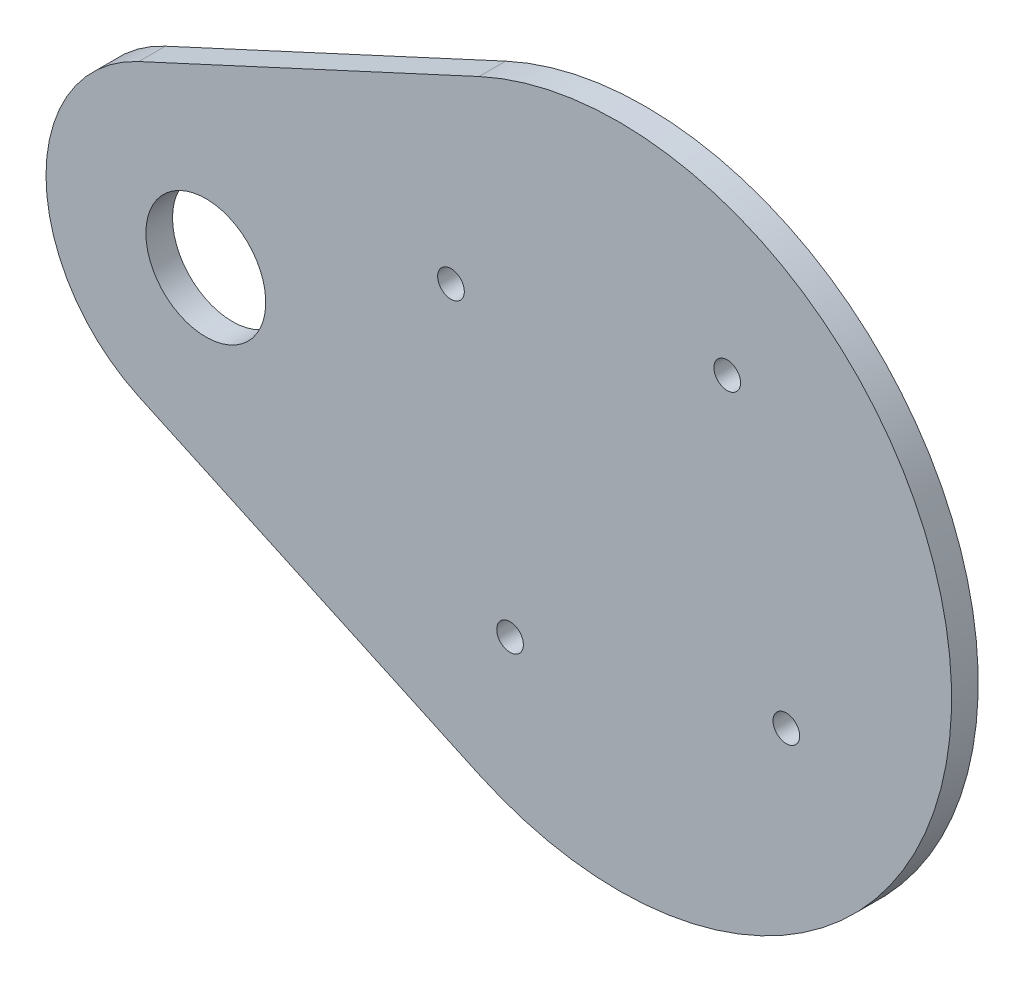
from build123d import *

# Parameters (mm, degrees)
SKETCH1_R           = 1
SKETCH1_R_2         = 7.5
BOSS_EXTRUDE1_DEPTH = 2


with BuildPart() as part:
    # Sketch1 → Boss-Extrude1 (new body)
    # profile 1 of 2: a face of its own
    with BuildSketch(Plane.XY):
        with BuildLine():
            ThreePointArc((-36.032258065, 10.893868862), (-43, 0), (-36.032258065, -10.893868862))
            Line((-36.032258065, -10.893868862), (-10.483870968, -22.695560128))
            ThreePointArc((-10.483870968, -22.695560128), (8.421796013, -23.538762752), (22.501635968, -10.893868862))
            ThreePointArc((22.501635968, -10.893868862), (25, 0), (22.501635968, 10.893868862))
            ThreePointArc((22.501635968, 10.893868862), (8.421796013, 23.538762752), (-10.483870968, 22.695560128))
            Line((-10.483870968, 22.695560128), (-36.032258065, 10.893868862))
        make_face()
        with Locations(Location((8.154330676, 12.589951995, 0), (0, 0, 180))):
            Circle(SKETCH1_R, mode=Mode.SUBTRACT)
        with Locations(Location((-8.154330676, -12.589951995, 0), (0, 0, 180))):
            Circle(SKETCH1_R, mode=Mode.SUBTRACT)
        with Locations((-31, 0)):
            Circle(SKETCH1_R_2, mode=Mode.SUBTRACT)
        with Locations(Location((12.589951995, -8.154330676, 0), (0, 0, 180))):
            Circle(SKETCH1_R, mode=Mode.SUBTRACT)
        with Locations(Location((-12.589951995, 8.154330676, 0), (0, 0, 180))):
            Circle(SKETCH1_R, mode=Mode.SUBTRACT)
    # profile 2 of 2: a face of its own
    with BuildSketch(Plane.XY):
        with Locations((-31, 0)):
            Circle(SKETCH1_R_2)
        with BuildLine():
            ThreePointArc((-35.198052011, 1.620604614), (-29.379395386, 4.198052011), (-26.801947989, -1.620604614))
            ThreePointArc((-26.801947989, -1.620604614), (-32.620604614, -4.198052011), (-35.198052011, 1.620604614))
        make_face(mode=Mode.SUBTRACT)
    extrude(amount=BOSS_EXTRUDE1_DEPTH)


solid = part.part
